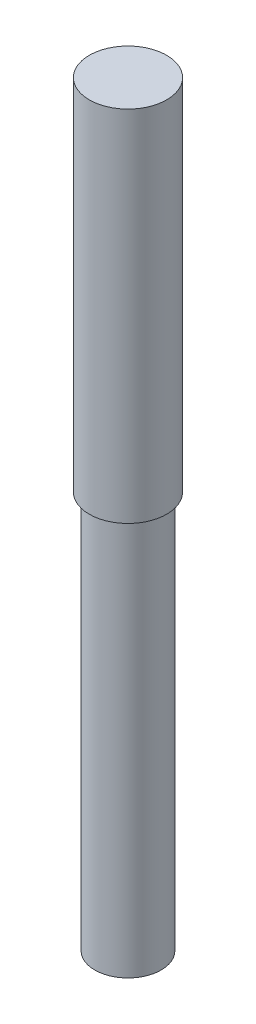
from build123d import *

# Parameters (mm, degrees)
SKETCH1_R           = 6
BOSS_EXTRUDE1_DEPTH = 72
SKETCH2_R           = 7
BOSS_EXTRUDE2_DEPTH = 65


with BuildPart() as part:
    # Sketch1 → Boss-Extrude1 (new body)
    with BuildSketch(Plane(origin=(0, 0, 0), x_dir=(1, 0, 0), z_dir=(0, 1, 0))):
        with Locations(Location((0, 0, 0), (0, 0, 270))):
            Circle(SKETCH1_R)
    extrude(amount=BOSS_EXTRUDE1_DEPTH)

    # Sketch2 → Boss-Extrude2 (add)
    with BuildSketch(Plane(origin=(0, 72, 0), x_dir=(1, 0, 0), z_dir=(0, 1, 0))):
        with Locations(Location((0, 0, 0), (0, 0, 270))):
            Circle(SKETCH2_R)
    extrude(amount=BOSS_EXTRUDE2_DEPTH)


solid = part.part
